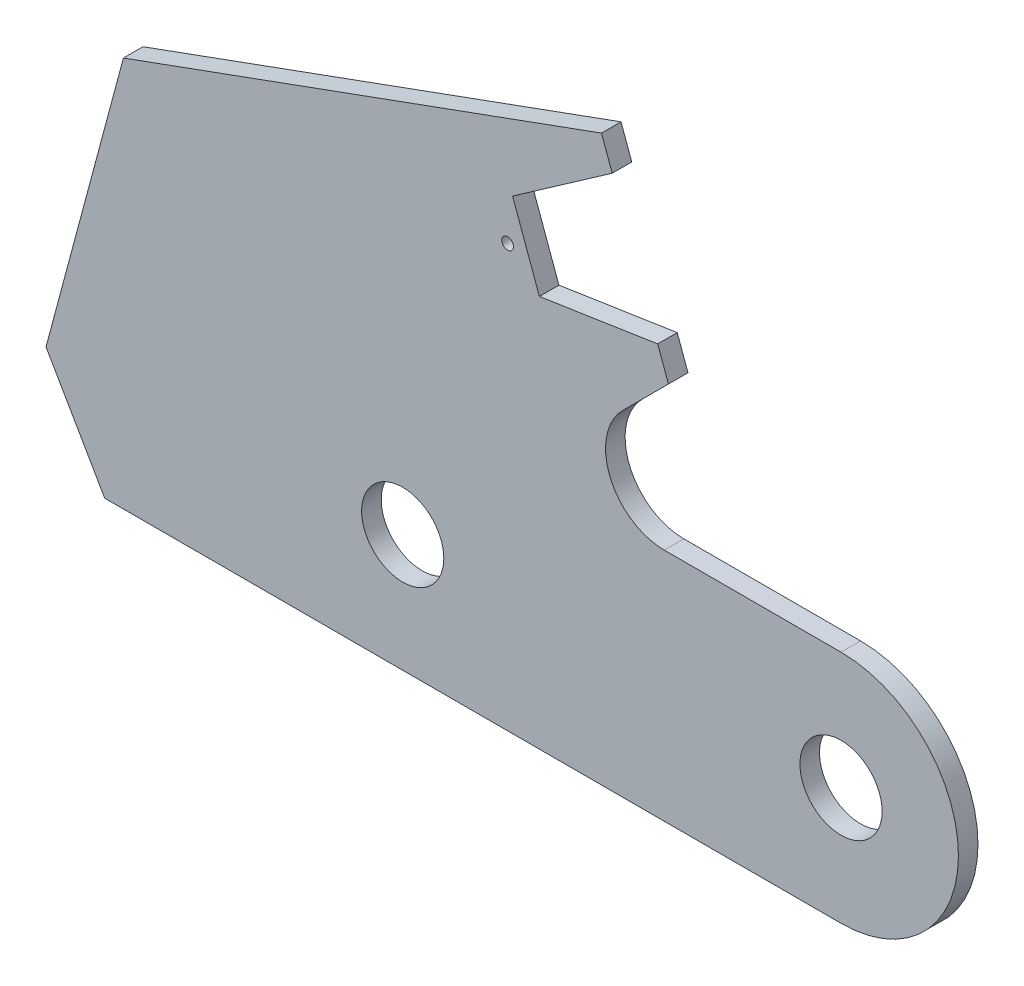
from build123d import *

# Parameters (mm, degrees)
SKETCH1_R           = 10.5
BOSS_EXTRUDE1_DEPTH = 5
FILLET1_R           = 15
SKETCH2_R           = 1.5
CUT_EXTRUDE1_DEPTH  = 5


with BuildPart() as part:
    # Sketch1 → Boss-Extrude1 (new body)
    with BuildSketch(Plane.XY):
        with BuildLine():
            Line((94.301272012, 107.23010703), (12.917479745, 107.23010703))
            Line((12.917479745, 107.23010703), (50.196394157, 144.509021441))
            Line((50.196394157, 144.509021441), (33.09538699, 191.493652481))
            Line((33.09538699, 191.493652481), (-89.064653712, 147.031033848))
            Line((-89.064653712, 147.031033848), (-108.84470723, 73.210869143))
            Line((-108.84470723, 73.210869143), (-93.84470723, 47.23010703))
            Line((-93.84470723, 47.23010703), (94.301272012, 47.23010703))
            ThreePointArc((94.301272012, 47.23010703), (124.301272012, 77.23010703), (94.301272012, 107.23010703))
        make_face()
        with Locations((-17.698727988, 77.23010703)):
            Circle(SKETCH1_R, mode=Mode.SUBTRACT)
        with Locations((94.301272012, 77.23010703)):
            Circle(SKETCH1_R, mode=Mode.SUBTRACT)
    extrude(amount=BOSS_EXTRUDE1_DEPTH)

    # Fillet1
    fillet1_edges = [part.edges().sort_by_distance(p)[0] for p in [
        (12.917479745, 107.23010703, 2.5),
    ]]
    fillet(fillet1_edges, radius=FILLET1_R)

    # Sketch2 → Cut-Extrude1 (cut)
    with BuildSketch(Plane.XY.offset(5)):
        with Locations((9.098668989, 155.090939324)):
            Circle(SKETCH2_R)
        Polygon((35.831548137, 183.976111514), (10.37693066, 166.197966248), (17.217333526, 147.404113833), (47.46023301, 152.026562408), align=None)
    extrude(amount=-CUT_EXTRUDE1_DEPTH, mode=Mode.SUBTRACT)


solid = part.part
